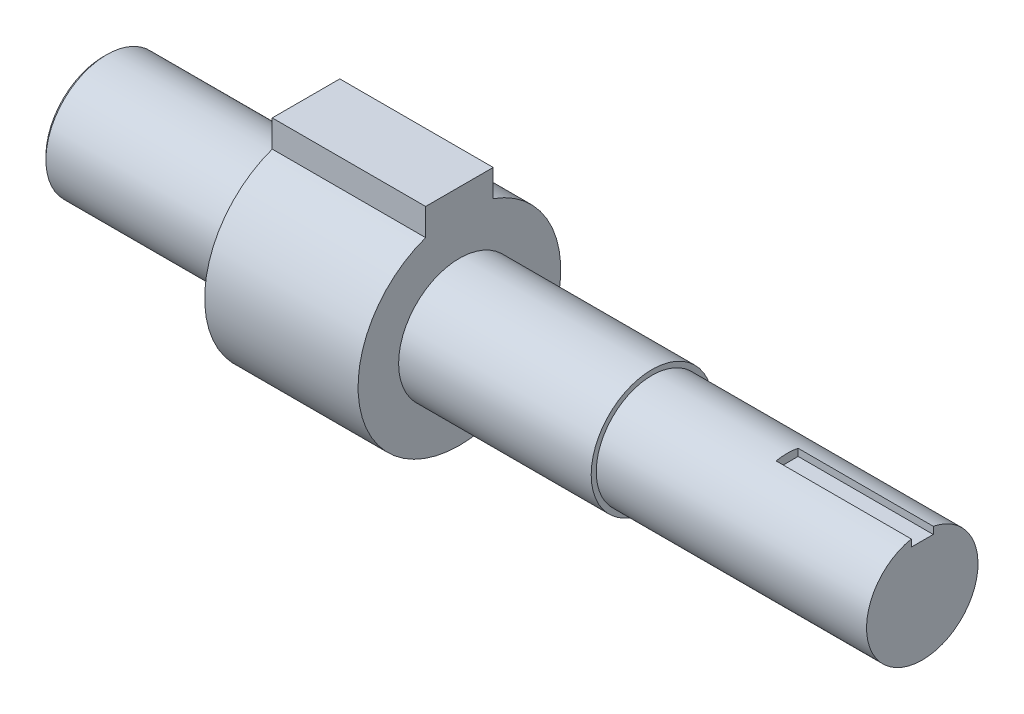
from build123d import *

# Parameters (mm, degrees)
SKETCH1_W           = 30
SKETCH1_H           = 9
BOSS_EXTRUDE1_DEPTH = 22.7
SKETCH3_R           = 9
BOSS_EXTRUDE2_DEPTH = 28.5
SKETCH4_R           = 8.25
BOSS_EXTRUDE3_DEPTH = 40
SKETCH5_W           = 3.25
SKETCH5_H           = 1.5
CUT_EXTRUDE1_DEPTH  = 20
CHAMFER1_SIZE       = 0.5


with BuildPart() as part:
    # Sketch1 → Revolve1 (revolve)
    with BuildSketch(Plane.XY, mode=Mode.PRIVATE) as revolve1_sk:
        with Locations((15, 4.5)):
            Rectangle(SKETCH1_W, SKETCH1_H)
    revolve(revolve1_sk.sketch.rotate(Axis((0, 0, 0), (1, 0, 0)), 90), axis=Axis((0, 0, 0), (1, 0, 0)))

    # Sketch2 → Boss-Extrude1 (add)
    with BuildSketch(Plane(origin=(30, 0, 0), x_dir=(0, 0, -1), z_dir=(1, 0, 0))):
        with BuildLine():
            Line((5, 18.142135624), (-5, 18.142135624))
            Line((-5, 18.142135624), (-5, 14.142135624))
            ThreePointArc((-5, 14.142135624), (0, -15), (5, 14.142135624))
            Line((5, 14.142135624), (5, 18.142135624))
        make_face()
    extrude(amount=BOSS_EXTRUDE1_DEPTH)

    # Sketch3 → Boss-Extrude2 (add)
    with BuildSketch(Plane(origin=(52.7, 0, 0), x_dir=(0, 0, -1), z_dir=(1, 0, 0))):
        with Locations(Location((0, 0, 0), (0, 0, 180))):
            Circle(SKETCH3_R)
    extrude(amount=BOSS_EXTRUDE2_DEPTH)

    # Sketch4 → Boss-Extrude3 (add)
    with BuildSketch(Plane(origin=(81.2, 0, 0), x_dir=(0, 0, -1), z_dir=(1, 0, 0))):
        Circle(SKETCH4_R)
    extrude(amount=BOSS_EXTRUDE3_DEPTH)

    # Sketch5 → Cut-Extrude1 (cut)
    with BuildSketch(Plane(origin=(121.2, 0, 0), x_dir=(0, 0, -1), z_dir=(1, 0, 0))):
        with Locations((0, 7.79)):
            Rectangle(SKETCH5_W, SKETCH5_H)
    extrude(amount=-CUT_EXTRUDE1_DEPTH, mode=Mode.SUBTRACT)

    # Chamfer1
    chamfer1_edges = [part.edges().sort_by_distance(p)[0] for p in [
        (0, 0, -9),
    ]]
    chamfer(chamfer1_edges, length=CHAMFER1_SIZE)


solid = part.part
